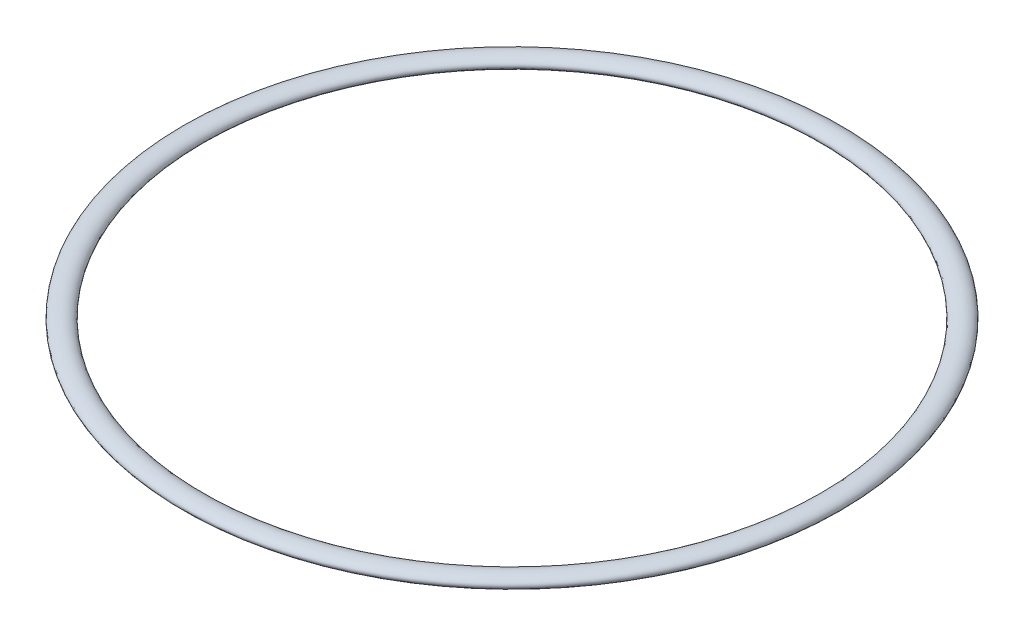
from build123d import *

# Parameters (mm, degrees)
RECONSTRUCTED_NOMINAL_AXIAL_PROFILE_RX = 1.364441432
RECONSTRUCTED_NOMINAL_AXIAL_PROFILE_RY = 0.725


with BuildPart() as part:
    # Reconstructed nominal axial profile → Native revolved geometry (revolve)
    with BuildSketch(Plane.XY):
        with Locations((39.425, 0)):
            Ellipse(RECONSTRUCTED_NOMINAL_AXIAL_PROFILE_RX, RECONSTRUCTED_NOMINAL_AXIAL_PROFILE_RY)
    revolve(axis=Axis((0, -500, 0), (0, 1, 0)))


solid = part.part
